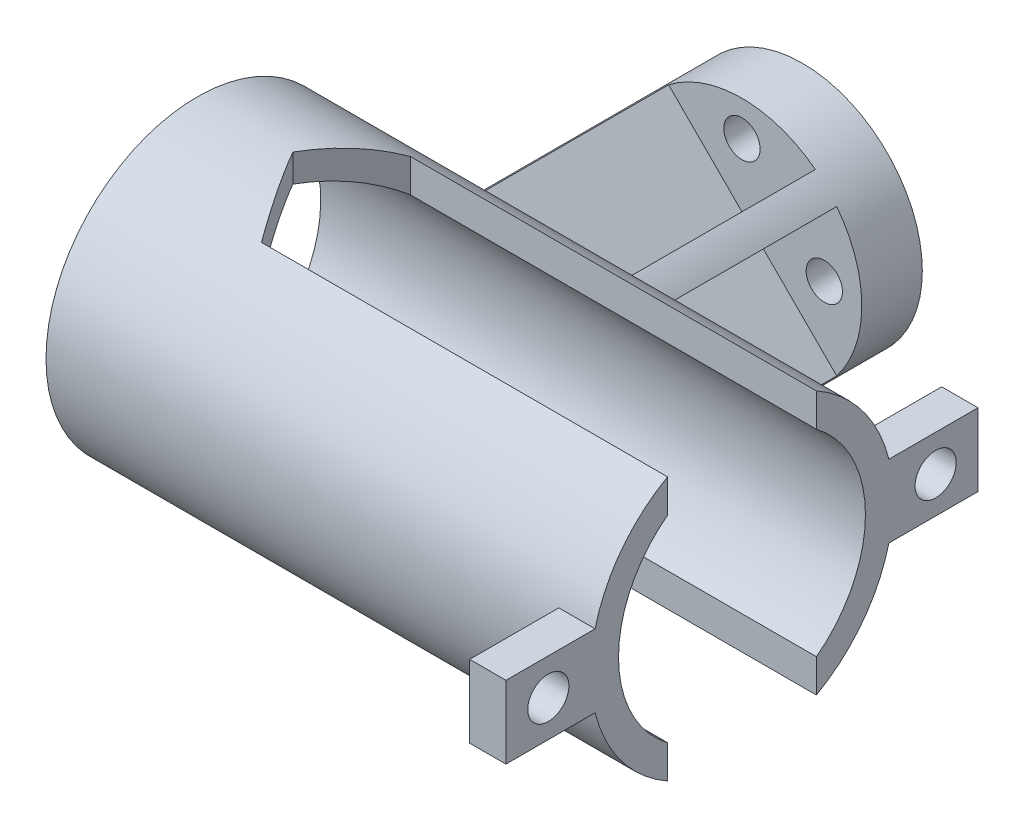
from build123d import *
from build123d.topology import SkipClean

# Parameters (mm, degrees)
SKETCH2_R               = 9.9
SKETCH2_R_2             = 1.5
BOSS_EXTRUDE1_DEPTH     = 5
BOSS_EXTRUDE2_DEPTH     = 15
BOSS_EXTRUDE3_DEPTH     = 20
BOSS_EXTRUDE4_REACH     = 52.99
CUT_EXTRUDE1_DEPTH      = 30
BOSS_EXTRUDE5_DEPTH     = 10
SKETCH8_R               = 10.2
CUT_EXTRUDE2_DEPTH      = 30
CUT_EXTRUDE6_DEPTH      = 55.10674639
CUT_EXTRUDE6_DEPTH_BACK = 55.10674639
BOSS_EXTRUDE6_START     = 10
BOSS_EXTRUDE6_DEPTH     = 10
BOSS_EXTRUDE7_DEPTH     = 3
SKETCH16_W              = 3
SKETCH16_H              = 6
BOSS_EXTRUDE8_DEPTH     = 2
SKETCH17_W              = 3
SKETCH17_H              = 6
BOSS_EXTRUDE9_DEPTH     = 2
CUT_EXTRUDE7_DEPTH      = 4
SKETCH19_R              = 12.5
SKETCH19_R_2            = 10.2
BOSS_EXTRUDE10_DEPTH    = 5


with BuildPart() as part:
    # Sketch2 → Boss-Extrude1 (new body)
    with BuildSketch(Plane.XY):
        with Locations((-9.8, 0)):
            Circle(SKETCH2_R)
        with Locations((-9.8, -6.601530997)):
            Circle(SKETCH2_R_2, mode=Mode.SUBTRACT)
        with Locations((-16.600765498, 0.199234502)):
            Circle(SKETCH2_R_2, mode=Mode.SUBTRACT)
        with Locations((-9.8, 7)):
            Circle(SKETCH2_R_2, mode=Mode.SUBTRACT)
        with Locations((-2.999234502, 0.199234502)):
            Circle(SKETCH2_R_2, mode=Mode.SUBTRACT)
    extrude(amount=BOSS_EXTRUDE1_DEPTH)

    # Sketch3 → Boss-Extrude2 (add)
    with BuildSketch(Plane.XY.offset(5)):
        with BuildLine():
            Line((-16.800357134, 7.000357134), (-10.683883476, 0.883883476))
            Line((-10.683883476, 0.883883476), (-9.8, 1.767766953))
            Line((-9.8, 1.767766953), (-15.860448745, 7.828215698))
            ThreePointArc((-15.860448745, 7.828215698), (-16.343508233, 7.429165498), (-16.800357134, 7.000357134))
        make_face()
        with BuildLine():
            Line((-11.567766953, 0), (-10.683883476, 0.883883476))
            Line((-10.683883476, 0.883883476), (-16.800357134, 7.000357134))
            ThreePointArc((-16.800357134, 7.000357134), (-17.229165498, 6.543508233), (-17.628215698, 6.060448745))
            Line((-17.628215698, 6.060448745), (-11.567766953, 0))
        make_face()
        Polygon((-10.683883476, 0.883883476), (-9.8, 0), (-8.916116524, 0.883883476), (-9.8, 1.767766953), align=None)
        Polygon((-8.916116524, 0.883883476), (-9.8, 0), (-8.916116524, -0.883883476), (-8.032233047, 0), align=None)
        Polygon((-8.916116524, -0.883883476), (-9.8, 0), (-9.8, -1.767766953), align=None)
        Polygon((-9.8, -1.767766953), (-9.8, 0), (-10.683883476, -0.883883476), align=None)
        Polygon((-10.683883476, -0.883883476), (-9.8, 0), (-10.683883476, 0.883883476), (-11.567766953, 0), align=None)
        with BuildLine():
            Line((-16.800357134, -7.000357134), (-10.683883476, -0.883883476))
            Line((-10.683883476, -0.883883476), (-11.567766953, 0))
            Line((-11.567766953, 0), (-17.628215698, -6.060448745))
            ThreePointArc((-17.628215698, -6.060448745), (-17.229165498, -6.543508233), (-16.800357134, -7.000357134))
        make_face()
        with BuildLine():
            Line((-15.860448745, -7.828215698), (-9.8, -1.767766953))
            Line((-9.8, -1.767766953), (-10.683883476, -0.883883476))
            Line((-10.683883476, -0.883883476), (-16.800357134, -7.000357134))
            ThreePointArc((-16.800357134, -7.000357134), (-16.343508233, -7.429165498), (-15.860448745, -7.828215698))
        make_face()
        with BuildLine():
            Line((-2.799642866, -7.000357134), (-8.916116524, -0.883883476))
            Line((-8.916116524, -0.883883476), (-9.8, -1.767766953))
            Line((-9.8, -1.767766953), (-3.739551255, -7.828215698))
            ThreePointArc((-3.739551255, -7.828215698), (-3.256491767, -7.429165498), (-2.799642866, -7.000357134))
        make_face()
        with BuildLine():
            Line((-8.032233047, 0), (-8.916116524, -0.883883476))
            Line((-8.916116524, -0.883883476), (-2.799642866, -7.000357134))
            ThreePointArc((-2.799642866, -7.000357134), (-2.370834502, -6.543508233), (-1.971784302, -6.060448745))
            Line((-1.971784302, -6.060448745), (-8.032233047, 0))
        make_face()
        with BuildLine():
            Line((-2.799642866, 7.000357134), (-8.916116524, 0.883883476))
            Line((-8.916116524, 0.883883476), (-8.032233047, 0))
            Line((-8.032233047, 0), (-1.971784302, 6.060448745))
            ThreePointArc((-1.971784302, 6.060448745), (-2.370834502, 6.543508233), (-2.799642866, 7.000357134))
        make_face()
        with BuildLine():
            Line((-9.8, 1.767766953), (-8.916116524, 0.883883476))
            Line((-8.916116524, 0.883883476), (-2.799642866, 7.000357134))
            ThreePointArc((-2.799642866, 7.000357134), (-3.256491767, 7.429165498), (-3.739551255, 7.828215698))
            Line((-3.739551255, 7.828215698), (-9.8, 1.767766953))
        make_face()
    extrude(amount=BOSS_EXTRUDE2_DEPTH)

    # Sketch4 → Boss-Extrude3 (add)
    with BuildSketch(Plane.XY.offset(20)):
        with BuildLine():
            Line((-3.739551255, -7.828215698), (-9.8, -1.767766953))
            Line((-9.8, -1.767766953), (-9.8, -10))
            Line((-9.8, -10), (5.2, -10))
            Line((5.2, -10), (5.2, 0))
            Line((5.2, 0), (-8.032233047, 0))
            Line((-8.032233047, 0), (-1.971784302, -6.060448745))
            ThreePointArc((-1.971784302, -6.060448745), (-2.799642866, -7.000357134), (-3.739551255, -7.828215698))
        make_face()
        with BuildLine():
            Line((-9.8, 10), (-9.8, 1.767766953))
            Line((-9.8, 1.767766953), (-3.739551255, 7.828215698))
            ThreePointArc((-3.739551255, 7.828215698), (-2.799642866, 7.000357134), (-1.971784302, 6.060448745))
            Line((-1.971784302, 6.060448745), (-8.032233047, 0))
            Line((-8.032233047, 0), (5.2, 0))
            Line((5.2, 0), (5.2, 10))
            Line((5.2, 10), (-9.8, 10))
        make_face()
        with BuildLine():
            Line((-15.860448745, 7.828215698), (-9.8, 1.767766953))
            Line((-9.8, 1.767766953), (-9.8, 10))
            Line((-9.8, 10), (-24.8, 10))
            Line((-24.8, 10), (-24.8, 0))
            Line((-24.8, 0), (-11.567766953, 0))
            Line((-11.567766953, 0), (-17.628215698, 6.060448745))
            ThreePointArc((-17.628215698, 6.060448745), (-16.800357134, 7.000357134), (-15.860448745, 7.828215698))
        make_face()
        with BuildLine():
            Line((-9.8, -10), (-9.8, -1.767766953))
            Line((-9.8, -1.767766953), (-15.860448745, -7.828215698))
            ThreePointArc((-15.860448745, -7.828215698), (-16.800357134, -7.000357134), (-17.628215698, -6.060448745))
            Line((-17.628215698, -6.060448745), (-11.567766953, 0))
            Line((-11.567766953, 0), (-24.8, 0))
            Line((-24.8, 0), (-24.8, -10))
            Line((-24.8, -10), (-9.8, -10))
        make_face()
        with BuildLine():
            Line((-8.032233047, 0), (-9.8, 0))
            Line((-9.8, 0), (-9.8, -1.767766953))
            Line((-9.8, -1.767766953), (-3.739551255, -7.828215698))
            ThreePointArc((-3.739551255, -7.828215698), (-2.799642866, -7.000357134), (-1.971784302, -6.060448745))
            Line((-1.971784302, -6.060448745), (-8.032233047, 0))
        make_face()
        with BuildLine():
            Line((-3.739551255, 7.828215698), (-9.8, 1.767766953))
            Line((-9.8, 1.767766953), (-9.8, 0))
            Line((-9.8, 0), (-8.032233047, 0))
            Line((-8.032233047, 0), (-1.971784302, 6.060448745))
            ThreePointArc((-1.971784302, 6.060448745), (-2.799642866, 7.000357134), (-3.739551255, 7.828215698))
        make_face()
        with BuildLine():
            Line((-9.8, 0), (-9.8, 1.767766953))
            Line((-9.8, 1.767766953), (-15.860448745, 7.828215698))
            ThreePointArc((-15.860448745, 7.828215698), (-16.800357134, 7.000357134), (-17.628215698, 6.060448745))
            Line((-17.628215698, 6.060448745), (-11.567766953, 0))
            Line((-11.567766953, 0), (-9.8, 0))
        make_face()
        with BuildLine():
            Line((-9.8, -1.767766953), (-9.8, 0))
            Line((-9.8, 0), (-11.567766953, 0))
            Line((-11.567766953, 0), (-17.628215698, -6.060448745))
            ThreePointArc((-17.628215698, -6.060448745), (-16.800357134, -7.000357134), (-15.860448745, -7.828215698))
            Line((-15.860448745, -7.828215698), (-9.8, -1.767766953))
        make_face()
    extrude(amount=BOSS_EXTRUDE3_DEPTH)

    # Boss-Extrude4: up to this face of the body (flat: up to its plane)
    boss_extrude4_end = Plane(part.part.faces().sort_by_distance((-24.8, 0, 30))[0])
    # Sketch5 → Boss-Extrude4 (add, up to the picked face)
    with BuildSketch(Plane(origin=(5.2, 0, 0), x_dir=(0, 0, -1), z_dir=(1, 0, 0)), mode=Mode.PRIVATE) as boss_extrude4_sk1:
        with BuildLine():
            Line((-20, -7.5), (-20, 0))
            Line((-20, 0), (-40, 0))
            Line((-40, 0), (-40, -7.5))
            ThreePointArc((-40, -7.5), (-38.838834765, -8.838834765), (-37.5, -10))
            Line((-37.5, -10), (-22.5, -10))
            ThreePointArc((-22.5, -10), (-21.161165235, -8.838834765), (-20, -7.5))
        make_face()
    boss_extrude4_tool1 = split(extrude(boss_extrude4_sk1.sketch, amount=-BOSS_EXTRUDE4_REACH, mode=Mode.PRIVATE), bisect_by=boss_extrude4_end, keep=Keep.BOTH, mode=Mode.PRIVATE)
    # Sketch5 → Boss-Extrude4 (add, up to the picked face)
    with BuildSketch(Plane(origin=(5.2, 0, 0), x_dir=(0, 0, -1), z_dir=(1, 0, 0)), mode=Mode.PRIVATE) as boss_extrude4_sk2:
        with BuildLine():
            Line((-20, 7.5), (-20, 0))
            Line((-20, 0), (-20, -7.5))
            ThreePointArc((-20, -7.5), (-18.141458774, -3.952847075), (-17.5, 0))
            ThreePointArc((-17.5, 0), (-18.141458774, 3.952847075), (-20, 7.5))
        make_face()
    boss_extrude4_tool2 = split(extrude(boss_extrude4_sk2.sketch, amount=-BOSS_EXTRUDE4_REACH, mode=Mode.PRIVATE), bisect_by=boss_extrude4_end, keep=Keep.BOTH, mode=Mode.PRIVATE)
    # Sketch5 → Boss-Extrude4 (add, up to the picked face)
    with BuildSketch(Plane(origin=(5.2, 0, 0), x_dir=(0, 0, -1), z_dir=(1, 0, 0)), mode=Mode.PRIVATE) as boss_extrude4_sk3:
        with BuildLine():
            ThreePointArc((-37.5, -10), (-30, -12.5), (-22.5, -10))
            Line((-22.5, -10), (-37.5, -10))
        make_face()
    boss_extrude4_tool3 = split(extrude(boss_extrude4_sk3.sketch, amount=-BOSS_EXTRUDE4_REACH, mode=Mode.PRIVATE), bisect_by=boss_extrude4_end, keep=Keep.BOTH, mode=Mode.PRIVATE)
    # Sketch5 → Boss-Extrude4 (add, up to the picked face)
    with BuildSketch(Plane(origin=(5.2, 0, 0), x_dir=(0, 0, -1), z_dir=(1, 0, 0)), mode=Mode.PRIVATE) as boss_extrude4_sk4:
        with BuildLine():
            Line((-40, -7.5), (-40, 0))
            Line((-40, 0), (-40, 7.5))
            ThreePointArc((-40, 7.5), (-42.5, 0), (-40, -7.5))
        make_face()
    boss_extrude4_tool4 = split(extrude(boss_extrude4_sk4.sketch, amount=-BOSS_EXTRUDE4_REACH, mode=Mode.PRIVATE), bisect_by=boss_extrude4_end, keep=Keep.BOTH, mode=Mode.PRIVATE)
    # Sketch5 → Boss-Extrude4 (add, up to the picked face)
    with BuildSketch(Plane(origin=(5.2, 0, 0), x_dir=(0, 0, -1), z_dir=(1, 0, 0)), mode=Mode.PRIVATE) as boss_extrude4_sk5:
        with BuildLine():
            Line((-37.5, 10), (-22.5, 10))
            ThreePointArc((-22.5, 10), (-30, 12.5), (-37.5, 10))
        make_face()
    boss_extrude4_tool5 = split(extrude(boss_extrude4_sk5.sketch, amount=-BOSS_EXTRUDE4_REACH, mode=Mode.PRIVATE), bisect_by=boss_extrude4_end, keep=Keep.BOTH, mode=Mode.PRIVATE)
    # Sketch5 → Boss-Extrude4 (add, up to the picked face)
    with BuildSketch(Plane(origin=(5.2, 0, 0), x_dir=(0, 0, -1), z_dir=(1, 0, 0)), mode=Mode.PRIVATE) as boss_extrude4_sk6:
        with BuildLine():
            Line((-40, 0), (-20, 0))
            Line((-20, 0), (-20, 7.5))
            ThreePointArc((-20, 7.5), (-21.161165235, 8.838834765), (-22.5, 10))
            Line((-22.5, 10), (-37.5, 10))
            ThreePointArc((-37.5, 10), (-38.838834765, 8.838834765), (-40, 7.5))
            Line((-40, 7.5), (-40, 0))
        make_face()
    boss_extrude4_tool6 = split(extrude(boss_extrude4_sk6.sketch, amount=-BOSS_EXTRUDE4_REACH, mode=Mode.PRIVATE), bisect_by=boss_extrude4_end, keep=Keep.BOTH, mode=Mode.PRIVATE)
    add(boss_extrude4_tool1.solids().sort_by(Axis((5.2, -4.877549, 30), (-1, 0, 0)))[0])
    add(boss_extrude4_tool2.solids().sort_by(Axis((5.2, 0, 18.9909), (-1, 0, 0)))[0])
    add(boss_extrude4_tool3.solids().sort_by(Axis((5.2, -11.0091, 30), (-1, 0, 0)))[0])
    add(boss_extrude4_tool4.solids().sort_by(Axis((5.2, 0, 41.0091), (-1, 0, 0)))[0])
    add(boss_extrude4_tool5.solids().sort_by(Axis((5.2, 11.0091, 30), (-1, 0, 0)))[0])
    add(boss_extrude4_tool6.solids().sort_by(Axis((5.2, 4.877549, 30), (-1, 0, 0)))[0])

    # Sketch6 → Cut-Extrude1 (cut)
    with SkipClean():  # the faces are left unmerged after this step: merging them gives an invalid solid
        with BuildSketch(Plane(origin=(5.2, 0, 0), x_dir=(0, 0, -1), z_dir=(1, 0, 0))):
            with BuildLine():
                Line((-22.5, -10), (-20, -10))
                Line((-20, -10), (-20, -7.5))
                ThreePointArc((-20, -7.5), (-21.161165235, -8.838834765), (-22.5, -10))
            make_face()
            with BuildLine():
                Line((-40, -10), (-37.5, -10))
                ThreePointArc((-37.5, -10), (-38.838834765, -8.838834765), (-40, -7.5))
                Line((-40, -7.5), (-40, -10))
            make_face()
            with BuildLine():
                ThreePointArc((-22.5, 10), (-21.161165235, 8.838834765), (-20, 7.5))
                Line((-20, 7.5), (-20, 10))
                Line((-20, 10), (-22.5, 10))
            make_face()
            with BuildLine():
                ThreePointArc((-40, 7.5), (-38.838834765, 8.838834765), (-37.5, 10))
                Line((-37.5, 10), (-40, 10))
                Line((-40, 10), (-40, 7.5))
            make_face()
        extrude(amount=-CUT_EXTRUDE1_DEPTH, mode=Mode.SUBTRACT)

    # Sketch7 → Boss-Extrude5 (add)
    with SkipClean():  # the faces are left unmerged after this step: merging them gives an invalid solid
        with BuildSketch(Plane.XY.offset(20)):
            with BuildLine():
                Line((-3.739551255, 7.828215698), (-4.067766953, 7.5))
                Line((-4.067766953, 7.5), (-3.337802231, 7.5))
                ThreePointArc((-3.337802231, 7.5), (-3.536526498, 7.666739834), (-3.739551255, 7.828215698))
            make_face()
            with BuildLine():
                Line((-16.262197769, 7.5), (-15.532233047, 7.5))
                Line((-15.532233047, 7.5), (-15.860448745, 7.828215698))
                ThreePointArc((-15.860448745, 7.828215698), (-16.063473502, 7.666739834), (-16.262197769, 7.5))
            make_face()
            with BuildLine():
                Line((-15.860448745, -7.828215698), (-15.532233047, -7.5))
                Line((-15.532233047, -7.5), (-16.262197769, -7.5))
                ThreePointArc((-16.262197769, -7.5), (-16.063473502, -7.666739834), (-15.860448745, -7.828215698))
            make_face()
            with BuildLine():
                Line((-3.337802231, -7.5), (-4.067766953, -7.5))
                Line((-4.067766953, -7.5), (-3.739551255, -7.828215698))
                ThreePointArc((-3.739551255, -7.828215698), (-3.536526498, -7.666739834), (-3.337802231, -7.5))
            make_face()
        extrude(amount=BOSS_EXTRUDE5_DEPTH)

    # Sketch8 → Cut-Extrude2 (cut)
    with SkipClean():  # the faces are left unmerged after this step: merging them gives an invalid solid
        with BuildSketch(Plane(origin=(5.2, 0, 0), x_dir=(0, 0, -1), z_dir=(1, 0, 0))):
            with Locations((-30, 0)):
                Circle(SKETCH8_R)
        extrude(amount=-CUT_EXTRUDE2_DEPTH, mode=Mode.SUBTRACT)

    # Sketch12 → Cut-Extrude6 (cut, two sides: drawn at the far end of the back side and taken through both)
    with SkipClean():  # the faces are left unmerged after this step: merging them gives an invalid solid
        with BuildSketch(Plane(origin=(0, 10, 0), x_dir=(1, 0, 0), z_dir=(0, 1, 0)).offset(-CUT_EXTRUDE6_DEPTH_BACK)):
            Polygon((8.750704156, -36.15), (12.301408311, -30), (8.750704156, -23.85), (1.649295844, -23.85), (-1.901408311, -30), (1.649295844, -36.15), align=None)
            Polygon((-1.901408311, -30), (1.649295844, -23.85), (-11.249295844, -23.85), (-7.698591689, -30), align=None)
            Polygon((-11.249295844, -36.15), (1.649295844, -36.15), (-1.901408311, -30), (-7.698591689, -30), align=None)
            Polygon((-7.698591689, -30), (-11.249295844, -23.85), (-18.350704156, -23.85), (-21.901408311, -30), (-18.350704156, -36.15), (-11.249295844, -36.15), align=None)
        extrude(amount=CUT_EXTRUDE6_DEPTH + CUT_EXTRUDE6_DEPTH_BACK, mode=Mode.SUBTRACT)

    # Sketch13 → Boss-Extrude6 (add)
    with SkipClean():  # the faces are left unmerged after this step: merging them gives an invalid solid
        with BuildSketch(Plane(origin=(5.2, 0, 0), x_dir=(0, 0, -1), z_dir=(1, 0, 0)).offset(BOSS_EXTRUDE6_START)):
            with BuildLine():
                Line((-36.15, 8.137413594), (-36.15, 10.882439984))
                ThreePointArc((-36.15, 10.882439984), (-42.5, 0), (-36.15, -10.882439984))
                Line((-36.15, -10.882439984), (-36.15, -8.137413594))
                ThreePointArc((-36.15, -8.137413594), (-40.2, 0), (-36.15, 8.137413594))
            make_face()
            with BuildLine():
                Line((-23.85, -8.137413594), (-23.85, -10.882439984))
                ThreePointArc((-23.85, -10.882439984), (-17.5, 0), (-23.85, 10.882439984))
                Line((-23.85, 10.882439984), (-23.85, 8.137413594))
                ThreePointArc((-23.85, 8.137413594), (-19.8, 0), (-23.85, -8.137413594))
            make_face()
        extrude(amount=-BOSS_EXTRUDE6_DEPTH)

    # Sketch14 → Boss-Extrude7 (add)
    with SkipClean():  # the faces are left unmerged after this step: merging them gives an invalid solid
        with BuildSketch(Plane(origin=(15.2, 0, 0), x_dir=(0, 0, -1), z_dir=(1, 0, 0))):
            with BuildLine():
                ThreePointArc((-17.5, 0), (-17.591670867, -1.511081774), (-17.8653389, -3))
                Line((-17.8653389, -3), (-17.5, -3))
                Line((-17.5, -3), (-12.5, -3))
                Line((-12.5, -3), (-12.5, 0))
                Line((-12.5, 0), (-17.5, 0))
            make_face()
            with BuildLine():
                Line((-17.5, 3), (-17.8653389, 3))
                ThreePointArc((-17.8653389, 3), (-17.591670867, 1.511081774), (-17.5, 0))
                Line((-17.5, 0), (-12.5, 0))
                Line((-12.5, 0), (-12.5, 3))
                Line((-12.5, 3), (-17.5, 3))
            make_face()
            with BuildLine():
                Line((-47.5, 0), (-42.5, 0))
                ThreePointArc((-42.5, 0), (-42.408329133, 1.511081774), (-42.1346611, 3))
                Line((-42.1346611, 3), (-42.5, 3))
                Line((-42.5, 3), (-47.5, 3))
                Line((-47.5, 3), (-47.5, 0))
            make_face()
            with BuildLine():
                ThreePointArc((-42.1346611, -3), (-42.408329133, -1.511081774), (-42.5, 0))
                Line((-42.5, 0), (-47.5, 0))
                Line((-47.5, 0), (-47.5, -3))
                Line((-47.5, -3), (-42.5, -3))
                Line((-42.5, -3), (-42.1346611, -3))
            make_face()
        extrude(amount=-BOSS_EXTRUDE7_DEPTH)

    # Sketch16 → Boss-Extrude8 (add)
    with SkipClean():  # the faces are left unmerged after this step: merging them gives an invalid solid
        with BuildSketch(Plane.XY.offset(47.5)):
            with Locations((13.7, 0)):
                Rectangle(SKETCH16_W, SKETCH16_H)
        extrude(amount=BOSS_EXTRUDE8_DEPTH)

    # Sketch17 → Boss-Extrude9 (add)
    with SkipClean():  # the faces are left unmerged after this step: merging them gives an invalid solid
        with BuildSketch(Plane(origin=(0, 0, 12.5), x_dir=(-1, 0, 0), z_dir=(0, 0, -1))):
            with Locations((-13.7, 0)):
                Rectangle(SKETCH17_W, SKETCH17_H)
        extrude(amount=BOSS_EXTRUDE9_DEPTH)

    # Sketch18 → Cut-Extrude7 (cut)
    with SkipClean():  # the faces are left unmerged after this step: merging them gives an invalid solid
        with BuildSketch(Plane(origin=(15.2, 0, 0), x_dir=(0, 0, -1), z_dir=(1, 0, 0))):
            with BuildLine():
                ThreePointArc((-15.7, 0), (-14, -1.7), (-12.3, 0))
                Line((-12.3, 0), (-15.7, 0))
            make_face()
            with BuildLine():
                Line((-15.7, 0), (-12.3, 0))
                ThreePointArc((-12.3, 0), (-14, 1.7), (-15.7, 0))
            make_face()
            with BuildLine():
                ThreePointArc((-15.7, 0), (-14, -1.7), (-12.3, 0))
                Line((-12.3, 0), (-15.7, 0))
            make_face()
            with BuildLine():
                Line((-15.7, 0), (-12.3, 0))
                ThreePointArc((-12.3, 0), (-14, 1.7), (-15.7, 0))
            make_face()
            with BuildLine():
                ThreePointArc((-47.7, 0), (-46, -1.7), (-44.3, 0))
                Line((-44.3, 0), (-47.7, 0))
            make_face()
            with BuildLine():
                Line((-47.7, 0), (-44.3, 0))
                ThreePointArc((-44.3, 0), (-46, 1.7), (-47.7, 0))
            make_face()
            with BuildLine():
                ThreePointArc((-47.7, 0), (-46, -1.7), (-44.3, 0))
                Line((-44.3, 0), (-47.7, 0))
            make_face()
            with BuildLine():
                Line((-47.7, 0), (-44.3, 0))
                ThreePointArc((-44.3, 0), (-46, 1.7), (-47.7, 0))
            make_face()
        extrude(amount=-CUT_EXTRUDE7_DEPTH, mode=Mode.SUBTRACT)

    # Sketch19 → Boss-Extrude10 (add)
    with SkipClean():  # the faces are left unmerged after this step: merging them gives an invalid solid
        with BuildSketch(Plane.ZY.offset(24.8)):
            with Locations(Location((30, 0, 0), (0, 0, 193.886540363))):
                Circle(SKETCH19_R)
            with Locations(Location((30, 0, 0), (0, 0, 127.080835588))):
                Circle(SKETCH19_R_2, mode=Mode.SUBTRACT)
        extrude(amount=BOSS_EXTRUDE10_DEPTH)


solid = part.part
